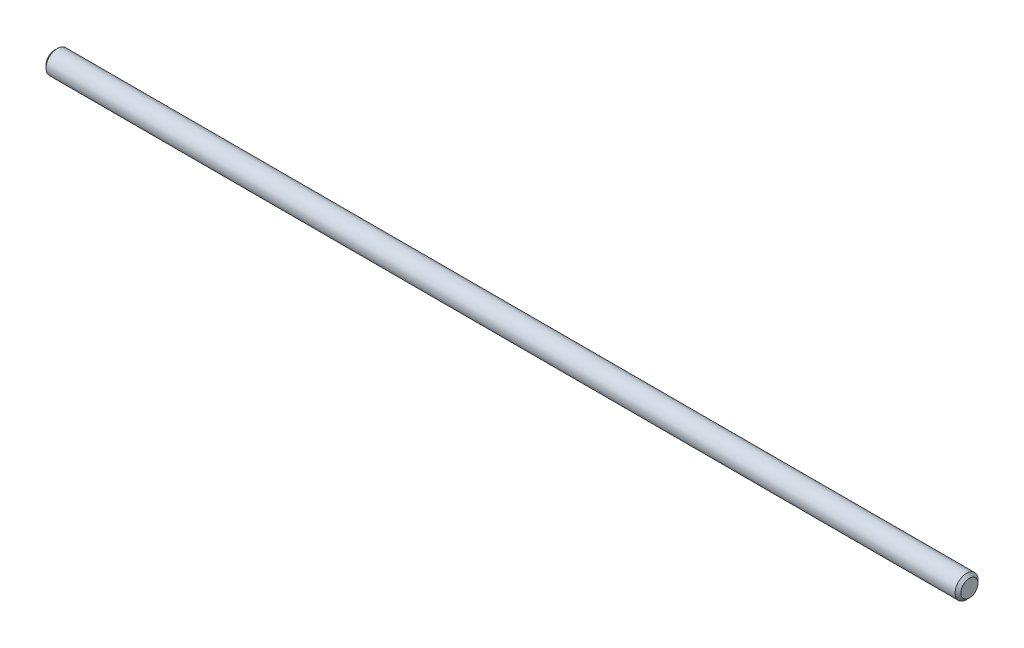
from build123d import *

# Parameters (mm, degrees)
SKETCH1_R           = 2
BOSS_EXTRUDE1_DEPTH = 80
CHAMFER1_SIZE       = 0.5


with BuildPart() as part:
    # Sketch1 → Boss-Extrude1 (new, symmetric)
    with BuildSketch(Plane(origin=(0, 0, 0), x_dir=(0, 0, -1), z_dir=(1, 0, 0))):
        Circle(SKETCH1_R)
    extrude(amount=BOSS_EXTRUDE1_DEPTH, both=True)

    # Chamfer1
    chamfer1_edges = [part.edges().sort_by_distance(p)[0] for p in [
        (-80, 0, 2),
        (80, 0, 2),
    ]]
    chamfer(chamfer1_edges, length=CHAMFER1_SIZE)


solid = part.part
